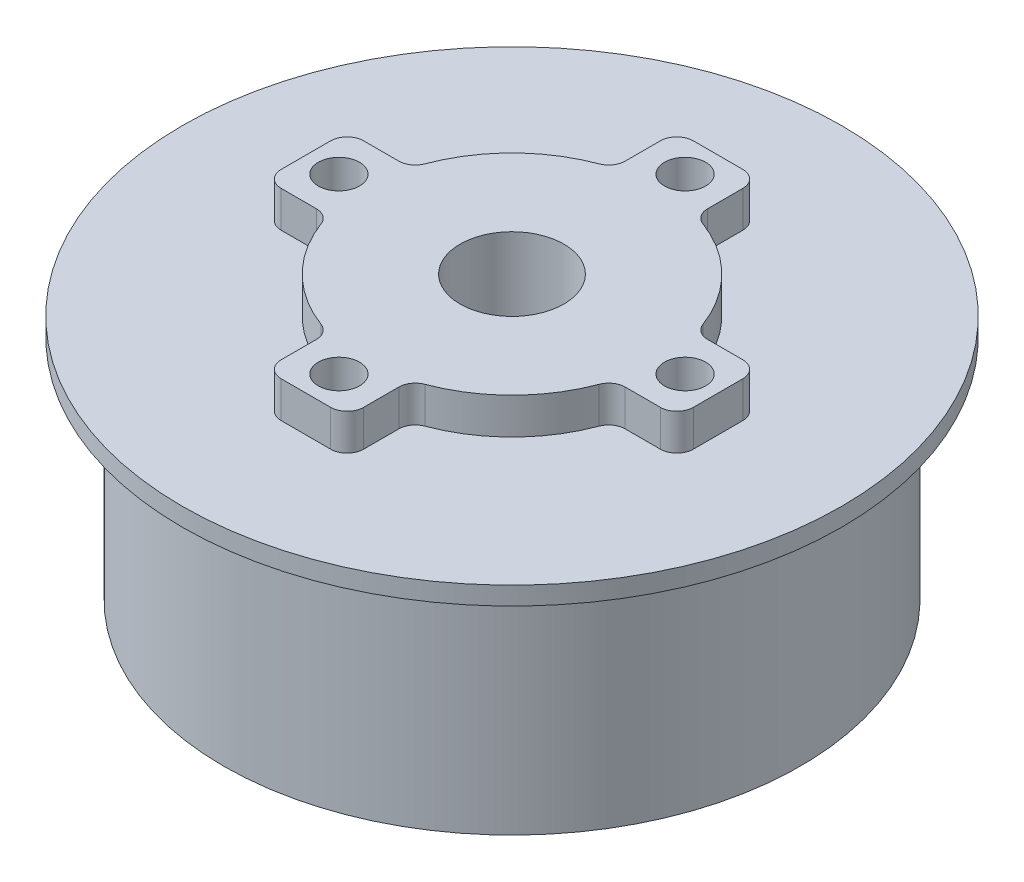
from build123d import *

# Parameters (mm, degrees)
SKETCH1_R           = 35
BOSS_EXTRUDE1_DEPTH = 27.6
SKETCH2_R           = 40
BOSS_EXTRUDE2_DEPTH = 2.2
BOSS_EXTRUDE3_DEPTH = 4.4
FILLET3_R           = 2
SKETCH4_R           = 6.3
CUT_EXTRUDE1_DEPTH  = 34.2
SKETCH5_R           = 2.5
CUT_EXTRUDE2_DEPTH  = 4.4


with BuildPart() as part:
    # Sketch1 → Boss-Extrude1 (new body)
    with BuildSketch(Plane(origin=(0, 0, 0), x_dir=(1, 0, 0), z_dir=(0, 1, 0))):
        with Locations(Location((0, 0, 0), (0, 0, 90))):
            Circle(SKETCH1_R)
    extrude(amount=BOSS_EXTRUDE1_DEPTH)

    # Sketch2 → Boss-Extrude2 (add)
    with BuildSketch(Plane(origin=(0, 27.6, 0), x_dir=(1, 0, 0), z_dir=(0, 1, 0))):
        with Locations(Location((0, 0, 0), (0, 0, 270))):
            Circle(SKETCH2_R)
    extrude(amount=BOSS_EXTRUDE2_DEPTH)

    # Sketch3 → Boss-Extrude3 (add)
    with BuildSketch(Plane(origin=(0, 29.8, 0), x_dir=(1, 0, 0), z_dir=(0, 1, 0))):
        with BuildLine():
            Line((-25, 5), (-17.291616466, 5))
            ThreePointArc((-17.291616466, 5), (-12.727922061, 12.727922061), (-5, 17.291616466))
            Line((-5, 17.291616466), (-5, 25))
            Line((-5, 25), (5, 25))
            Line((5, 25), (5, 17.291616466))
            ThreePointArc((5, 17.291616466), (12.727922061, 12.727922061), (17.291616466, 5))
            Line((17.291616466, 5), (25, 5))
            Line((25, 5), (25, -5))
            Line((25, -5), (17.291616466, -5))
            ThreePointArc((17.291616466, -5), (12.727922061, -12.727922061), (5, -17.291616466))
            Line((5, -17.291616466), (5, -25))
            Line((5, -25), (-5, -25))
            Line((-5, -25), (-5, -17.291616466))
            ThreePointArc((-5, -17.291616466), (-12.727922061, -12.727922061), (-17.291616466, -5))
            Line((-17.291616466, -5), (-25, -5))
            Line((-25, -5), (-25, 5))
        make_face()
    extrude(amount=BOSS_EXTRUDE3_DEPTH)

    # Fillet3
    fillet3_edges = [part.edges().sort_by_distance(p)[0] for p in [
        (-25, 32, -5),
        (-25, 32, 5),
        (-17.291616466, 32, 5),
        (-5, 32, 17.291616466),
        (-5, 32, 25),
        (5, 32, 25),
        (5, 32, 17.291616466),
        (17.291616466, 32, 5),
        (25, 32, 5),
        (25, 32, -5),
        (17.291616466, 32, -5),
        (5, 32, -17.291616466),
        (5, 32, -25),
        (-5, 32, -25),
        (-5, 32, -17.291616466),
        (-17.291616466, 32, -5),
    ]]
    fillet(fillet3_edges, radius=FILLET3_R)

    # Sketch4 → Cut-Extrude1 (cut)
    with BuildSketch(Plane(origin=(0, 34.2, 0), x_dir=(1, 0, 0), z_dir=(0, 1, 0))):
        with Locations(Location((0, 0, 0), (0, 0, 270))):
            Circle(SKETCH4_R)
    extrude(amount=-CUT_EXTRUDE1_DEPTH, mode=Mode.SUBTRACT)

    # Sketch5 → Cut-Extrude2 (cut)
    with BuildSketch(Plane(origin=(0, 34.2, 0), x_dir=(1, 0, 0), z_dir=(0, 1, 0))):
        with Locations(Location((21, 0, 0), (0, 0, 270))):
            Circle(SKETCH5_R)
        with Locations(Location((0, -21, 0), (0, 0, 270))):
            Circle(SKETCH5_R)
        with Locations(Location((-21, 0, 0), (0, 0, 270))):
            Circle(SKETCH5_R)
        with Locations(Location((0, 21, 0), (0, 0, 270))):
            Circle(SKETCH5_R)
    extrude(amount=-CUT_EXTRUDE2_DEPTH, mode=Mode.SUBTRACT)


solid = part.part
